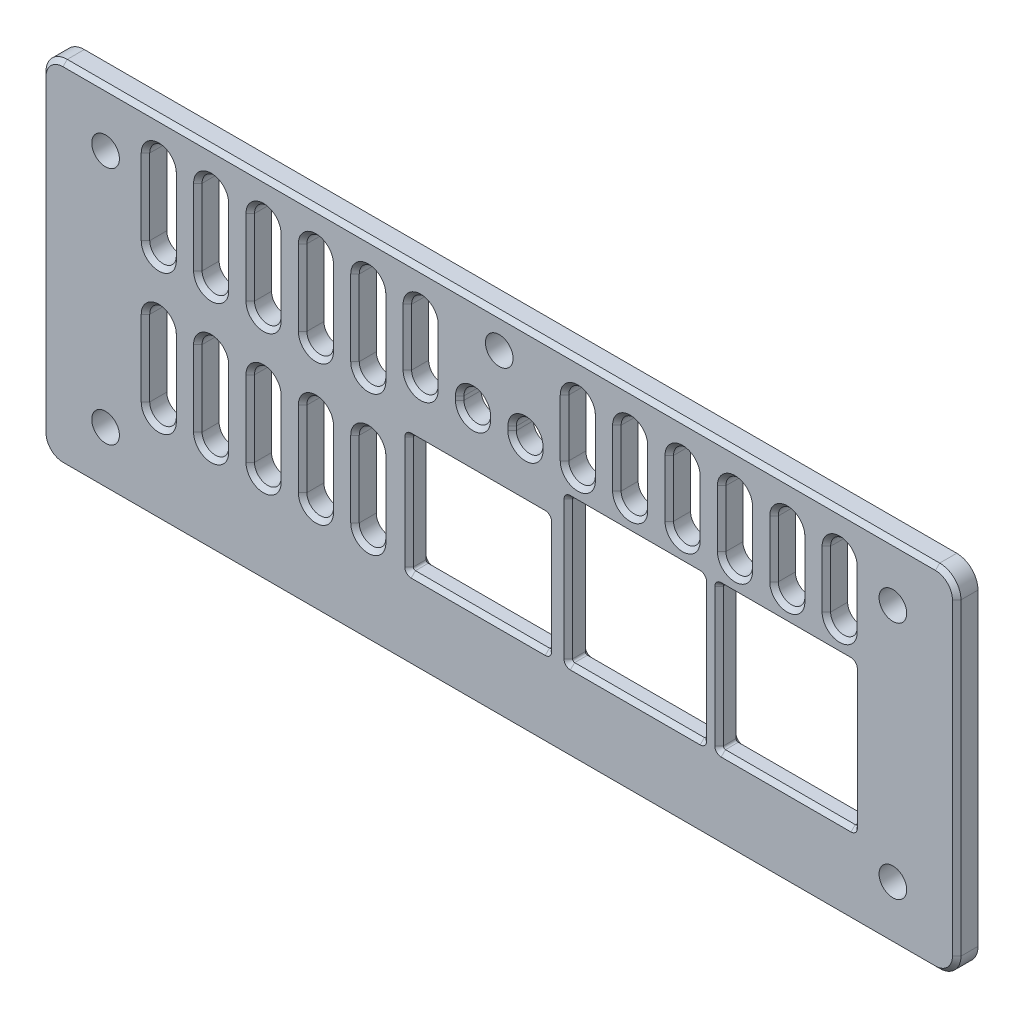
from build123d import *

# Parameters (mm, degrees)
SKETCH1_W               = 109.22
SKETCH1_H               = 41.91
BOSS_EXTRUDE1_DEPTH     = 2.54
CUT_EXTRUDE2_DEPTH      = 59.547550974
CUT_EXTRUDE2_DEPTH_BACK = 59.547550974
SKETCH4_R               = 1.651
FILLET1_R               = 2.54
SKETCH3_W               = 16.002
SKETCH3_H               = 17.018
SKETCH3_W_2             = 16.51
SKETCH3_H_2             = 13.97
RPI_3_CUTOUT_DEPTH      = 59.547550974
SKETCH14_R              = 1.651
CUT_EXTRUDE8_DEPTH      = 59.547550974
CUT_EXTRUDE9_DEPTH      = 59.547550974
CUT_EXTRUDE15_DEPTH     = 59.547550974
FILLET3_R               = 0.254
CHAMFER2_SIZE           = 0.508
CHAMFER3_SIZE           = 0.508


with BuildPart() as part:
    # Sketch1 → Boss-Extrude1 (new body)
    with BuildSketch(Plane.XY):
        Rectangle(SKETCH1_W, SKETCH1_H)
    extrude(amount=BOSS_EXTRUDE1_DEPTH)

    # Sketch4 → Cut-Extrude2 (cut, two sides: drawn at the far end of the back side and taken through both)
    with BuildSketch(Plane.XY.offset(2.54).offset(-CUT_EXTRUDE2_DEPTH_BACK)):
        with Locations((-46.99, 14.2875)):
            Circle(SKETCH4_R)
        with Locations((-46.99, -14.2875)):
            Circle(SKETCH4_R)
        with Locations((46.99, -14.2875)):
            Circle(SKETCH4_R)
        with Locations((46.99, 14.2875)):
            Circle(SKETCH4_R)
    extrude(amount=CUT_EXTRUDE2_DEPTH + CUT_EXTRUDE2_DEPTH_BACK, mode=Mode.SUBTRACT)

    # Fillet1
    fillet1_edges = [part.edges().sort_by_distance(p)[0] for p in [
        (-54.61, 20.955, 1.27),
        (54.61, 20.955, 1.27),
        (54.61, -20.955, 1.27),
        (-54.61, -20.955, 1.27),
    ]]
    fillet(fillet1_edges, radius=FILLET1_R)

    # Sketch3 → RPi 3 Cutout (cut, through all)
    with BuildSketch(Plane.XY.offset(2.54)):
        with Locations((16.24, -2.6162)):
            Rectangle(SKETCH3_W, SKETCH3_H)
        with Locations((34.24, -2.6162)):
            Rectangle(SKETCH3_W, SKETCH3_H)
        with Locations((-2.51, -4.1402)):
            Rectangle(SKETCH3_W_2, SKETCH3_H_2)
    extrude(amount=-RPI_3_CUTOUT_DEPTH, mode=Mode.SUBTRACT)

    # Sketch14 → Cut-Extrude8 (cut, through all)
    with BuildSketch(Plane.XY.offset(2.54)):
        with Locations((0, 17.145)):
            Circle(SKETCH14_R)
    extrude(amount=-CUT_EXTRUDE8_DEPTH, mode=Mode.SUBTRACT)

    # Sketch15 → Cut-Extrude9 (cut, through all)
    with BuildSketch(Plane.XY.offset(2.54)):
        with BuildLine():
            Line((39.0525, 9.3853), (39.0525, 16.1925))
            ThreePointArc((39.0525, 16.1925), (40.64, 17.78), (42.2275, 16.1925))
            Line((42.2275, 16.1925), (42.2275, 9.3853))
            ThreePointArc((42.2275, 9.3853), (40.64, 7.7978), (39.0525, 9.3853))
        make_face()
        with BuildLine():
            Line((32.800192308, 9.3853), (32.800192308, 16.1925))
            ThreePointArc((32.800192308, 16.1925), (34.387692308, 17.78), (35.975192308, 16.1925))
            Line((35.975192308, 16.1925), (35.975192308, 9.3853))
            ThreePointArc((35.975192308, 9.3853), (34.387692308, 7.7978), (32.800192308, 9.3853))
        make_face()
        with BuildLine():
            Line((26.547884615, 9.3853), (26.547884615, 16.1925))
            ThreePointArc((26.547884615, 16.1925), (28.135384615, 17.78), (29.722884615, 16.1925))
            Line((29.722884615, 16.1925), (29.722884615, 9.3853))
            ThreePointArc((29.722884615, 9.3853), (28.135384615, 7.7978), (26.547884615, 9.3853))
        make_face()
        with BuildLine():
            Line((20.295576923, 9.3853), (20.295576923, 16.1925))
            ThreePointArc((20.295576923, 16.1925), (21.883076923, 17.78), (23.470576923, 16.1925))
            Line((23.470576923, 16.1925), (23.470576923, 9.3853))
            ThreePointArc((23.470576923, 9.3853), (21.883076923, 7.7978), (20.295576923, 9.3853))
        make_face()
        with BuildLine():
            Line((14.043269231, 9.3853), (14.043269231, 16.1925))
            ThreePointArc((14.043269231, 16.1925), (15.630769231, 17.78), (17.218269231, 16.1925))
            Line((17.218269231, 16.1925), (17.218269231, 9.3853))
            ThreePointArc((17.218269231, 9.3853), (15.630769231, 7.7978), (14.043269231, 9.3853))
        make_face()
        with BuildLine():
            Line((7.790961538, 9.3853), (7.790961538, 16.1925))
            ThreePointArc((7.790961538, 16.1925), (9.378461538, 17.78), (10.965961538, 16.1925))
            Line((10.965961538, 16.1925), (10.965961538, 9.3853))
            ThreePointArc((10.965961538, 9.3853), (9.378461538, 7.7978), (7.790961538, 9.3853))
        make_face()
        with BuildLine():
            Line((-10.965961538, 9.3853), (-10.965961538, 16.1925))
            ThreePointArc((-10.965961538, 16.1925), (-9.378461538, 17.78), (-7.790961538, 16.1925))
            Line((-7.790961538, 16.1925), (-7.790961538, 9.3853))
            ThreePointArc((-7.790961538, 9.3853), (-9.378461538, 7.7978), (-10.965961538, 9.3853))
        make_face()
        with BuildLine():
            Line((-4.713653846, 9.3853), (-4.713653846, 9.849037529))
            ThreePointArc((-4.713653846, 9.849037529), (-3.126153846, 11.436537529), (-1.538653846, 9.849037529))
            Line((-1.538653846, 9.849037529), (-1.538653846, 9.3853))
            ThreePointArc((-1.538653846, 9.3853), (-3.126153846, 7.7978), (-4.713653846, 9.3853))
        make_face()
        with BuildLine():
            Line((1.538653846, 9.3853), (1.538653846, 9.849037529))
            ThreePointArc((1.538653846, 9.849037529), (3.126153846, 11.436537529), (4.713653846, 9.849037529))
            Line((4.713653846, 9.849037529), (4.713653846, 9.3853))
            ThreePointArc((4.713653846, 9.3853), (3.126153846, 7.7978), (1.538653846, 9.3853))
        make_face()
        with BuildLine():
            Line((-17.218269231, 9.3853), (-17.218269231, 16.1925))
            ThreePointArc((-17.218269231, 16.1925), (-15.630769231, 17.78), (-14.043269231, 16.1925))
            Line((-14.043269231, 16.1925), (-14.043269231, 9.3853))
            ThreePointArc((-14.043269231, 9.3853), (-15.630769231, 7.7978), (-17.218269231, 9.3853))
        make_face()
        with BuildLine():
            Line((-23.470576923, 9.3853), (-23.470576923, 16.1925))
            ThreePointArc((-23.470576923, 16.1925), (-21.883076923, 17.78), (-20.295576923, 16.1925))
            Line((-20.295576923, 16.1925), (-20.295576923, 9.3853))
            ThreePointArc((-20.295576923, 9.3853), (-21.883076923, 7.7978), (-23.470576923, 9.3853))
        make_face()
        with BuildLine():
            Line((-29.722884615, 9.3853), (-29.722884615, 16.1925))
            ThreePointArc((-29.722884615, 16.1925), (-28.135384615, 17.78), (-26.547884615, 16.1925))
            Line((-26.547884615, 16.1925), (-26.547884615, 9.3853))
            ThreePointArc((-26.547884615, 9.3853), (-28.135384615, 7.7978), (-29.722884615, 9.3853))
        make_face()
        with BuildLine():
            Line((-35.975192308, 9.3853), (-35.975192308, 16.1925))
            ThreePointArc((-35.975192308, 16.1925), (-34.387692308, 17.78), (-32.800192308, 16.1925))
            Line((-32.800192308, 16.1925), (-32.800192308, 9.3853))
            ThreePointArc((-32.800192308, 9.3853), (-34.387692308, 7.7978), (-35.975192308, 9.3853))
        make_face()
        with BuildLine():
            Line((-42.2275, 9.3853), (-42.2275, 16.1925))
            ThreePointArc((-42.2275, 16.1925), (-40.64, 17.78), (-39.0525, 16.1925))
            Line((-39.0525, 16.1925), (-39.0525, 9.3853))
            ThreePointArc((-39.0525, 9.3853), (-40.64, 7.7978), (-42.2275, 9.3853))
        make_face()
    extrude(amount=-CUT_EXTRUDE9_DEPTH, mode=Mode.SUBTRACT)

    # Sketch22 → Cut-Extrude15 (cut, through all)
    with BuildSketch(Plane.XY.offset(2.54)):
        with BuildLine():
            Line((-42.2275, -9.5377), (-42.2275, -0.4826))
            ThreePointArc((-42.2275, -0.4826), (-40.64, 1.1049), (-39.0525, -0.4826))
            Line((-39.0525, -0.4826), (-39.0525, -9.5377))
            ThreePointArc((-39.0525, -9.5377), (-40.64, -11.1252), (-42.2275, -9.5377))
        make_face()
        with BuildLine():
            Line((-42.2275, 7.1374), (-42.2275, 16.1925))
            ThreePointArc((-42.2275, 16.1925), (-40.64, 17.78), (-39.0525, 16.1925))
            Line((-39.0525, 16.1925), (-39.0525, 7.1374))
            ThreePointArc((-39.0525, 7.1374), (-40.64, 5.5499), (-42.2275, 7.1374))
        make_face()
        with BuildLine():
            Line((-35.975192308, -9.5377), (-35.975192308, -0.4826))
            ThreePointArc((-35.975192308, -0.4826), (-34.387692308, 1.1049), (-32.800192308, -0.4826))
            Line((-32.800192308, -0.4826), (-32.800192308, -9.5377))
            ThreePointArc((-32.800192308, -9.5377), (-34.387692308, -11.1252), (-35.975192308, -9.5377))
        make_face()
        with BuildLine():
            Line((-35.975192308, 7.1374), (-35.975192308, 16.1925))
            ThreePointArc((-35.975192308, 16.1925), (-34.387692308, 17.78), (-32.800192308, 16.1925))
            Line((-32.800192308, 16.1925), (-32.800192308, 7.1374))
            ThreePointArc((-32.800192308, 7.1374), (-34.387692308, 5.5499), (-35.975192308, 7.1374))
        make_face()
        with BuildLine():
            Line((-29.722884615, -9.5377), (-29.722884615, -0.4826))
            ThreePointArc((-29.722884615, -0.4826), (-28.135384615, 1.1049), (-26.547884615, -0.4826))
            Line((-26.547884615, -0.4826), (-26.547884615, -9.5377))
            ThreePointArc((-26.547884615, -9.5377), (-28.135384615, -11.1252), (-29.722884615, -9.5377))
        make_face()
        with BuildLine():
            Line((-29.722884615, 7.1374), (-29.722884615, 16.1925))
            ThreePointArc((-29.722884615, 16.1925), (-28.135384615, 17.78), (-26.547884615, 16.1925))
            Line((-26.547884615, 16.1925), (-26.547884615, 7.1374))
            ThreePointArc((-26.547884615, 7.1374), (-28.135384615, 5.5499), (-29.722884615, 7.1374))
        make_face()
        with BuildLine():
            Line((-23.470576923, -9.5377), (-23.470576923, -0.4826))
            ThreePointArc((-23.470576923, -0.4826), (-21.883076923, 1.1049), (-20.295576923, -0.4826))
            Line((-20.295576923, -0.4826), (-20.295576923, -9.5377))
            ThreePointArc((-20.295576923, -9.5377), (-21.883076923, -11.1252), (-23.470576923, -9.5377))
        make_face()
        with BuildLine():
            Line((-23.470576923, 7.1374), (-23.470576923, 16.1925))
            ThreePointArc((-23.470576923, 16.1925), (-21.883076923, 17.78), (-20.295576923, 16.1925))
            Line((-20.295576923, 16.1925), (-20.295576923, 7.1374))
            ThreePointArc((-20.295576923, 7.1374), (-21.883076923, 5.5499), (-23.470576923, 7.1374))
        make_face()
        with BuildLine():
            Line((-17.218269231, -9.5377), (-17.218269231, -0.4826))
            ThreePointArc((-17.218269231, -0.4826), (-15.630769231, 1.1049), (-14.043269231, -0.4826))
            Line((-14.043269231, -0.4826), (-14.043269231, -9.5377))
            ThreePointArc((-14.043269231, -9.5377), (-15.630769231, -11.1252), (-17.218269231, -9.5377))
        make_face()
        with BuildLine():
            Line((-17.218269231, 7.1374), (-17.218269231, 16.1925))
            ThreePointArc((-17.218269231, 16.1925), (-15.630769231, 17.78), (-14.043269231, 16.1925))
            Line((-14.043269231, 16.1925), (-14.043269231, 7.1374))
            ThreePointArc((-14.043269231, 7.1374), (-15.630769231, 5.5499), (-17.218269231, 7.1374))
        make_face()
    extrude(amount=-CUT_EXTRUDE15_DEPTH, mode=Mode.SUBTRACT)

    # Fillet3
    fillet3_edges = [part.edges().sort_by_distance(p)[0] for p in [
        (-10.765, -11.1252, 1.27),
        (-10.765, 2.8448, 1.27),
        (5.745, 2.8448, 1.27),
        (5.745, -11.1252, 1.27),
        (26.239, -11.1252, 1.27),
        (26.239, 5.8928, 1.27),
        (42.241, 5.8928, 1.27),
        (42.241, -11.1252, 1.27),
        (8.239, -11.1252, 1.27),
        (8.239, 5.8928, 1.27),
        (24.241, 5.8928, 1.27),
        (24.241, -11.1252, 1.27),
    ]]
    fillet(fillet3_edges, radius=FILLET3_R)

    # Chamfer2
    chamfer2_edges = [part.edges().sort_by_distance(p)[0] for p in [
        (16.24, 5.8928, 0),
        (24.241, -2.6162, 0),
        (34.24, 5.8928, 0),
        (42.241, -2.6162, 0),
        (16.24, -11.1252, 0),
        (34.24, -11.1252, 0),
        (8.239, -2.6162, 0),
        (26.239, -2.6162, 0),
        (-2.51, -11.1252, 0),
        (-10.765, -4.1402, 0),
        (-2.51, 2.8448, 0),
        (5.745, -4.1402, 0),
        (24.166605122, 5.818405122, 0),
        (42.166605122, 5.818405122, 0),
        (24.166605122, -11.050805122, 0),
        (42.166605122, -11.050805122, 0),
        (8.313394878, -11.050805122, 0),
        (26.313394878, -11.050805122, 0),
        (-10.690605122, -11.050805122, 0),
        (8.313394878, 5.818405122, 0),
        (26.313394878, 5.818405122, 0),
        (-10.690605122, 2.770405122, 0),
        (5.670605122, 2.770405122, 0),
        (5.670605122, -11.050805122, 0),
    ]]
    chamfer(chamfer2_edges, length=CHAMFER2_SIZE)

    # Chamfer3
    chamfer3_edges = [part.edges().sort_by_distance(p)[0] for p in [
        (40.64, 7.7978, 2.54),
        (42.2275, 12.7889, 2.54),
        (40.64, 17.78, 2.54),
        (39.0525, 12.7889, 2.54),
        (34.387692308, 7.7978, 2.54),
        (35.975192308, 12.7889, 2.54),
        (34.387692308, 17.78, 2.54),
        (32.800192308, 12.7889, 2.54),
        (28.135384615, 7.7978, 2.54),
        (29.722884615, 12.7889, 2.54),
        (28.135384615, 17.78, 2.54),
        (26.547884615, 12.7889, 2.54),
        (21.883076923, 7.7978, 2.54),
        (23.470576923, 12.7889, 2.54),
        (21.883076923, 17.78, 2.54),
        (20.295576923, 12.7889, 2.54),
        (15.630769231, 7.7978, 2.54),
        (17.218269231, 12.7889, 2.54),
        (15.630769231, 17.78, 2.54),
        (14.043269231, 12.7889, 2.54),
        (3.126153846, 7.7978, 2.54),
        (4.713653846, 9.617168764, 2.54),
        (3.126153846, 11.436537529, 2.54),
        (1.538653846, 9.617168764, 2.54),
        (-3.126153846, 7.7978, 2.54),
        (-1.538653846, 9.617168764, 2.54),
        (-3.126153846, 11.436537529, 2.54),
        (-4.713653846, 9.617168764, 2.54),
        (-9.378461538, 7.7978, 2.54),
        (-7.790961538, 12.7889, 2.54),
        (-9.378461538, 17.78, 2.54),
        (-10.965961538, 12.7889, 2.54),
        (9.378461538, 7.7978, 2.54),
        (10.965961538, 12.7889, 2.54),
        (9.378461538, 17.78, 2.54),
        (7.790961538, 12.7889, 2.54),
        (-14.043269231, 11.66495, 2.54),
        (-15.630769231, 17.78, 2.54),
        (-17.218269231, 11.66495, 2.54),
        (-20.295576923, 11.66495, 2.54),
        (-21.883076923, 17.78, 2.54),
        (-23.470576923, 11.66495, 2.54),
        (-26.547884615, 11.66495, 2.54),
        (-28.135384615, 17.78, 2.54),
        (-29.722884615, 11.66495, 2.54),
        (-32.800192308, 11.66495, 2.54),
        (-34.387692308, 17.78, 2.54),
        (-35.975192308, 11.66495, 2.54),
        (-39.0525, 11.66495, 2.54),
        (-40.64, 17.78, 2.54),
        (-42.2275, 11.66495, 2.54),
        (-28.135384615, 5.5499, 2.54),
        (0, 20.955, 2.54),
        (-21.883076923, -11.1252, 2.54),
        (-20.295576923, -5.01015, 2.54),
        (-21.883076923, 1.1049, 2.54),
        (-23.470576923, -5.01015, 2.54),
        (-21.883076923, 5.5499, 2.54),
        (-15.630769231, -11.1252, 2.54),
        (-14.043269231, -5.01015, 2.54),
        (-15.630769231, 1.1049, 2.54),
        (-17.218269231, -5.01015, 2.54),
        (-40.64, 5.5499, 2.54),
        (-34.387692308, -11.1252, 2.54),
        (-32.800192308, -5.01015, 2.54),
        (-34.387692308, 1.1049, 2.54),
        (-35.975192308, -5.01015, 2.54),
        (-34.387692308, 5.5499, 2.54),
        (-28.135384615, -11.1252, 2.54),
        (-26.547884615, -5.01015, 2.54),
        (-28.135384615, 1.1049, 2.54),
        (-29.722884615, -5.01015, 2.54),
        (54.61, 0, 2.54),
        (-15.630769231, 5.5499, 2.54),
        (-40.64, -11.1252, 2.54),
        (-39.0525, -5.01015, 2.54),
        (-40.64, 1.1049, 2.54),
        (-42.2275, -5.01015, 2.54),
        (-54.61, 0, 2.54),
        (0, -20.955, 2.54),
        (-53.866051224, 20.211051224, 2.54),
        (-53.866051224, -20.211051224, 2.54),
        (53.866051224, -20.211051224, 2.54),
        (53.866051224, 20.211051224, 2.54),
        (16.24, 5.8928, 2.54),
        (24.241, -2.6162, 2.54),
        (34.24, 5.8928, 2.54),
        (42.241, -2.6162, 2.54),
        (16.24, -11.1252, 2.54),
        (34.24, -11.1252, 2.54),
        (8.239, -2.6162, 2.54),
        (26.239, -2.6162, 2.54),
        (-2.51, -11.1252, 2.54),
        (-10.765, -4.1402, 2.54),
        (-2.51, 2.8448, 2.54),
        (5.745, -4.1402, 2.54),
        (24.166605122, 5.818405122, 2.54),
        (42.166605122, 5.818405122, 2.54),
        (24.166605122, -11.050805122, 2.54),
        (42.166605122, -11.050805122, 2.54),
        (8.313394878, -11.050805122, 2.54),
        (26.313394878, -11.050805122, 2.54),
        (-10.690605122, -11.050805122, 2.54),
        (8.313394878, 5.818405122, 2.54),
        (26.313394878, 5.818405122, 2.54),
        (-10.690605122, 2.770405122, 2.54),
        (5.670605122, 2.770405122, 2.54),
        (5.670605122, -11.050805122, 2.54),
    ]]
    chamfer(chamfer3_edges, length=CHAMFER3_SIZE)


solid = part.part
